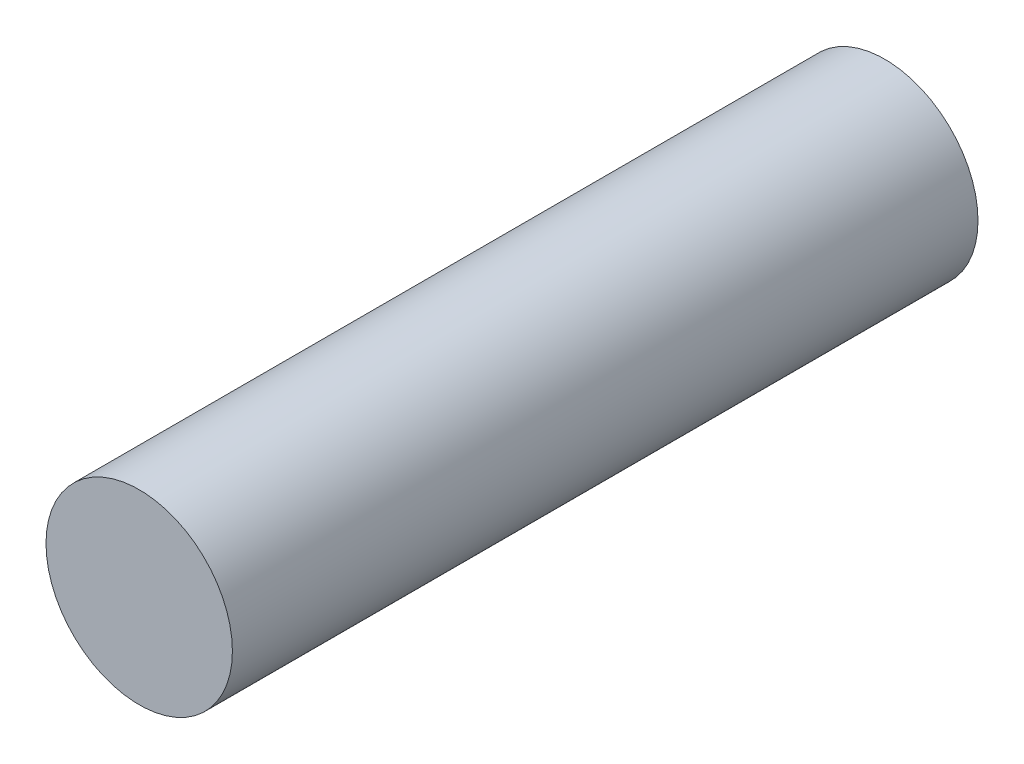
from build123d import *

# Parameters (mm, degrees)
SKETCH1_R           = 3.175
BOSS_EXTRUDE1_DEPTH = 25.4


with BuildPart() as part:
    # Sketch1 → Boss-Extrude1 (new body)
    with BuildSketch(Plane(origin=(0, 0, 0), x_dir=(0, 1, 0), z_dir=(0, 0, 1))):
        with Locations(Location((0, 0, 0), (0, 0, 270))):
            Circle(SKETCH1_R)
    extrude(amount=BOSS_EXTRUDE1_DEPTH)


solid = part.part
